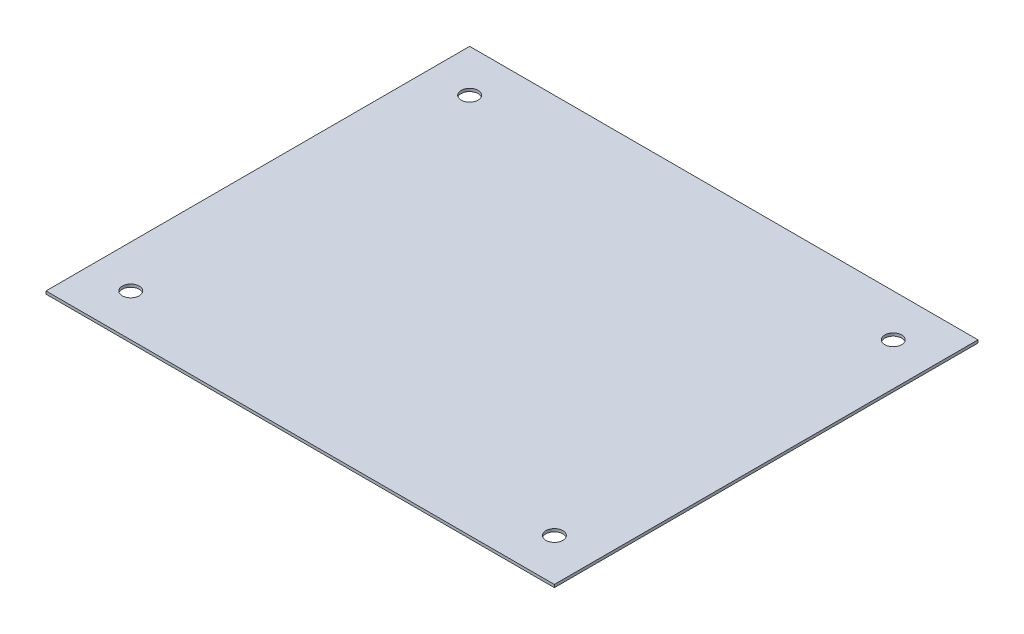
from build123d import *

# Parameters (mm, degrees)
IZIM1_W                     = 180
IZIM1_H                     = 150
Y_KSEKLIK_EKSTR_ZYON1_DEPTH = 1
IZIM2_R                     = 3
KES_EKSTR_ZYON1_DEPTH       = 25


with BuildPart() as part:
    # Çizim1 → Yükseklik-Ekstrüzyon1 (new body)
    with BuildSketch(Plane(origin=(0, 0, 0), x_dir=(1, 0, 0), z_dir=(0, 1, 0))):
        Rectangle(IZIM1_W, IZIM1_H)
    extrude(amount=Y_KSEKLIK_EKSTR_ZYON1_DEPTH)

    # Çizim2 → Kes-Ekstrüzyon1 (cut, symmetric)
    with BuildSketch(Plane(origin=(0, 1, 0), x_dir=(1, 0, 0), z_dir=(0, 1, 0))):
        with Locations(Location((-75, 60, 0), (0, 0, 270))):
            Circle(IZIM2_R)
        with Locations(Location((75, 60, 0), (0, 0, 270))):
            Circle(IZIM2_R)
        with Locations(Location((75, -60, 0), (0, 0, 270))):
            Circle(IZIM2_R)
        with Locations(Location((-75, -60, 0), (0, 0, 270))):
            Circle(IZIM2_R)
    extrude(amount=KES_EKSTR_ZYON1_DEPTH, both=True, mode=Mode.SUBTRACT)


solid = part.part
